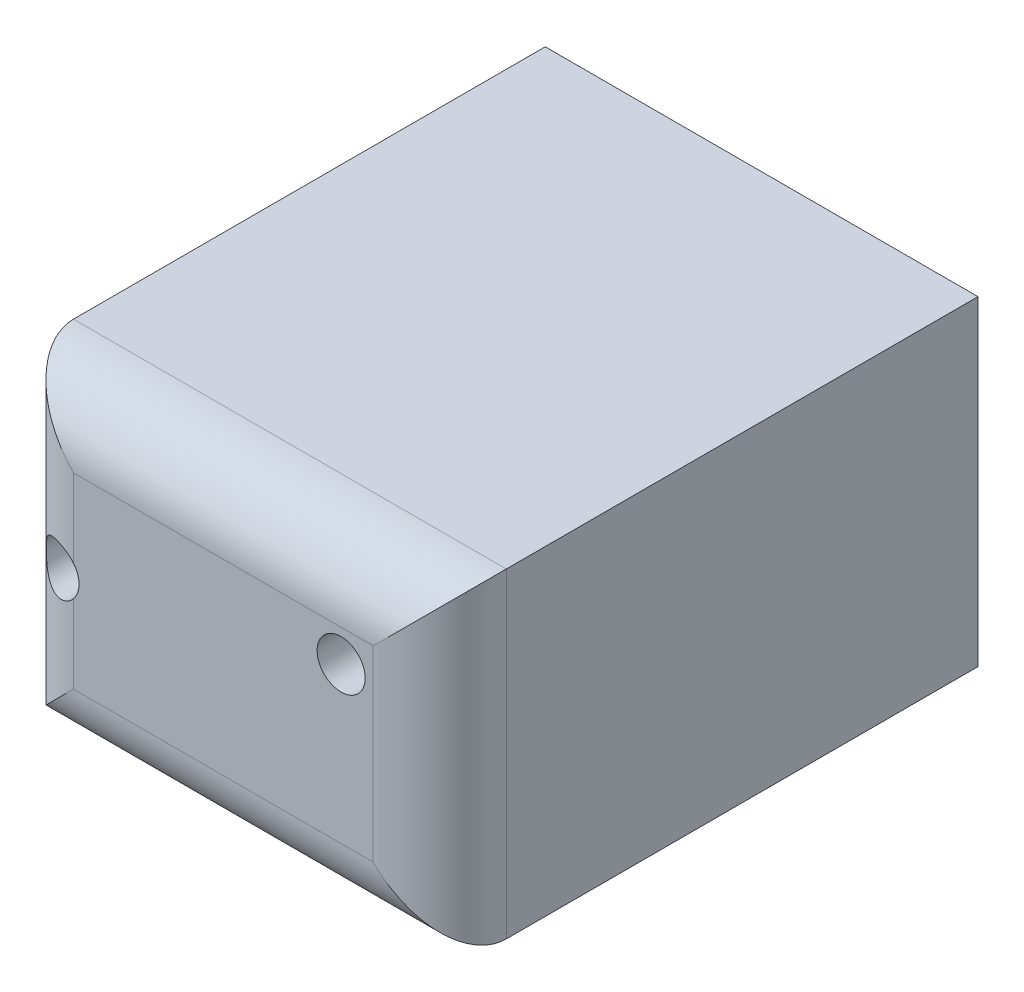
from build123d import *

# Parameters (mm, degrees)
SKIZZE1_W                                           = 135.069444444
SKIZZE1_H                                           = 100
AUFSATZ_LINEAR_AUSTRAGEN1_DEPTH                     = 168
SCHNITT_LINEAR_AUSTRAGEN1_DEPTH                     = 222.286589794
SCHNITT_LINEAR_AUSTRAGEN2_DEPTH                     = 207.845204696
SPIEGELN2_COPY_1_DEPTH                              = 222.286589794
SPIEGELN2_COPY_2_DEPTH                              = 222.286589794
STIRNSENKUNG_F_R_M8_SENKSCHRAUBE_KOPF_B_D           = 9
STIRNSENKUNG_F_R_M8_SENKSCHRAUBE_KOPF_B_CBORE_D     = 15
STIRNSENKUNG_F_R_M8_SENKSCHRAUBE_KOPF_B_CBORE_DEPTH = 161
STIRNSENKUNG_F_R_M8_SENKSCHRAUBE_KO_2_D             = 9
STIRNSENKUNG_F_R_M8_SENKSCHRAUBE_KO_2_CBORE_D       = 15
STIRNSENKUNG_F_R_M8_SENKSCHRAUBE_KO_2_CBORE_DEPTH   = 161


with BuildPart() as part:
    # Skizze1 → Aufsatz-Linear austragen1 (new body)
    with BuildSketch(Plane.XY):
        Rectangle(SKIZZE1_W, SKIZZE1_H)
    extrude(amount=AUFSATZ_LINEAR_AUSTRAGEN1_DEPTH)

    # Skizze2 → Schnitt-Linear austragen1 (cut, through all)
    with BuildSketch(Plane(origin=(67.534722222, 0, 0), x_dir=(0, 0, -1), z_dir=(1, 0, 0))):
        with BuildLine():
            Line((-147.230769231, 50), (18.556111772, 50))
            Line((18.556111772, 50), (-294.033910821, 102.758784569))
            Line((-294.033910821, 102.758784569), (-168, -33.660289563))
            Line((-168, -33.660289563), (-168, 29.230769231))
            ThreePointArc((-168, 29.230769231), (-161.916833148, 43.916833148), (-147.230769231, 50))
        make_face()
    schnitt_linear_austragen1 = extrude(amount=-SCHNITT_LINEAR_AUSTRAGEN1_DEPTH, mode=Mode.SUBTRACT)

    # Skizze3 → Schnitt-Linear austragen2 (cut, through all)
    with BuildSketch(Plane.XZ.offset(50)):
        with BuildLine():
            Line((67.534722222, 147.230769231), (67.534722222, 12.080316404))
            Line((67.534722222, 12.080316404), (116.298873036, 236.387140366))
            Line((116.298873036, 236.387140366), (-16.125567341, 168))
            Line((-16.125567341, 168), (46.765491453, 168))
            ThreePointArc((46.765491453, 168), (61.45155537, 161.916833148), (67.534722222, 147.230769231))
        make_face()
    schnitt_linear_austragen2 = extrude(amount=-SCHNITT_LINEAR_AUSTRAGEN2_DEPTH, mode=Mode.SUBTRACT)

    # Spiegeln1: Schnitt-Linear austragen1 across plane
    add(schnitt_linear_austragen1.mirror(Plane.ZX), mode=Mode.SUBTRACT)

    # Spiegeln2: Schnitt-Linear austragen2 across plane
    add(schnitt_linear_austragen2.mirror(Plane(origin=(0, 0, 0), x_dir=(0, 0, 1), z_dir=(1, 0, 0))), mode=Mode.SUBTRACT)

    # Spiegeln2 copy 1 sketch → Spiegeln2 copy 1 (cut, through all)
    with BuildSketch(Plane(origin=(-67.534722222, 0, 0), x_dir=(0, 0, -1), z_dir=(-1, 0, 0))):
        with BuildLine():
            Line((-147.230769231, 50), (18.556111772, 50))
            Line((18.556111772, 50), (-294.033910821, 102.758784569))
            Line((-294.033910821, 102.758784569), (-168, -33.660289563))
            Line((-168, -33.660289563), (-168, 29.230769231))
            ThreePointArc((-168, 29.230769231), (-161.916833148, 43.916833148), (-147.230769231, 50))
        make_face()
    extrude(amount=-SPIEGELN2_COPY_1_DEPTH, mode=Mode.SUBTRACT)

    # Spiegeln2 copy 2 sketch → Spiegeln2 copy 2 (cut, through all)
    with BuildSketch(Plane(origin=(-67.534722222, 0, 0), x_dir=(0, 0, -1), z_dir=(-1, 0, 0))):
        with BuildLine():
            Line((-147.230769231, -50), (18.556111772, -50))
            Line((18.556111772, -50), (-294.033910821, -102.758784569))
            Line((-294.033910821, -102.758784569), (-168, 33.660289563))
            Line((-168, 33.660289563), (-168, -29.230769231))
            ThreePointArc((-168, -29.230769231), (-161.916833148, -43.916833148), (-147.230769231, -50))
        make_face()
    extrude(amount=-SPIEGELN2_COPY_2_DEPTH, mode=Mode.SUBTRACT)

    # Stirnsenkung f_r M8 Senkschraube _Kopf B (through all)
    with Locations(Plane.XY.offset(168)):
        with Locations((-52.534722222, 0)):
            CounterBoreHole(STIRNSENKUNG_F_R_M8_SENKSCHRAUBE_KOPF_B_D / 2, STIRNSENKUNG_F_R_M8_SENKSCHRAUBE_KOPF_B_CBORE_D / 2, STIRNSENKUNG_F_R_M8_SENKSCHRAUBE_KOPF_B_CBORE_DEPTH)

    # Stirnsenkung f_r M8 Senkschraube _Ko 2 (through all)
    with Locations(Plane.XY.offset(168)):
        with Locations((36.765491453, 19.230769231)):
            CounterBoreHole(STIRNSENKUNG_F_R_M8_SENKSCHRAUBE_KO_2_D / 2, STIRNSENKUNG_F_R_M8_SENKSCHRAUBE_KO_2_CBORE_D / 2, STIRNSENKUNG_F_R_M8_SENKSCHRAUBE_KO_2_CBORE_DEPTH)


solid = part.part
